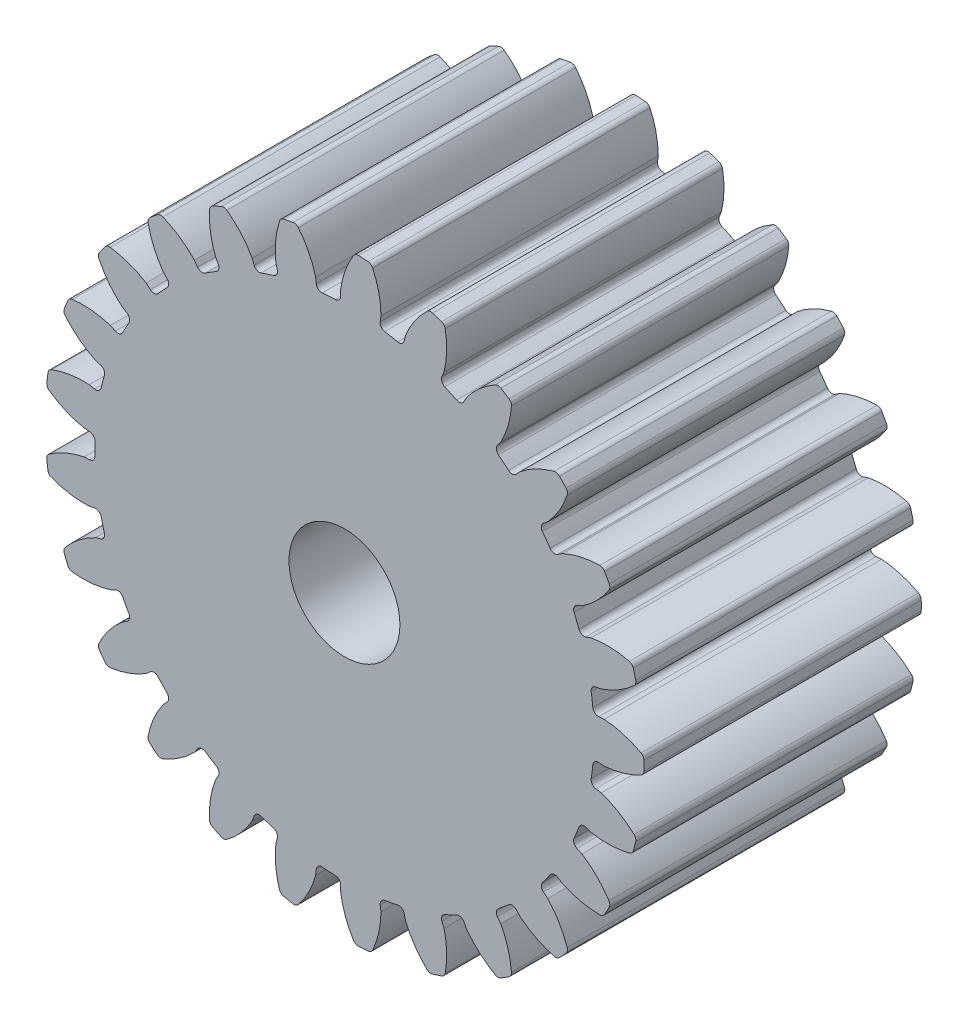
from build123d import *

# Parameters (mm, degrees)
SKETCH_1_R                       = 4.5
SKETCH_1_R_2                     = 1
EXTRUDE_1_DEPTH                  = 2.5
EXTRUDE_2_REACH                  = 8.837
EXTRUDE_2_DIRECTION_2_REACH      = 8.837
FILLET_1_R                       = 0.1
PATTERN_CIRCULAR_1_COUNT         = 25
FILLET_1_OF_PATTERN_CIRCULAR_1_R = 0.1


with BuildPart() as part:
    # Эскиз1 → Бобышка-Вытянуть1 (new, symmetric)
    with BuildSketch(Plane.XY):
        Circle(SKETCH_1_R)
        Circle(SKETCH_1_R_2, mode=Mode.SUBTRACT)
    extrude(amount=EXTRUDE_1_DEPTH, both=True)

    # Бобышка-Вытянуть2: up to this face of the body (flat: up to its plane)
    extrude_2_end = Plane(part.part.faces().sort_by_distance((-4.372720779, 0, 2.5))[0])
    # Эскиз2 → Бобышка-Вытянуть2 (add, up to the picked face)
    with BuildSketch(Plane.XY, mode=Mode.PRIVATE) as extrude_2_sk1:
        with BuildLine():
            Line((-0.070025105, 4.697941254), (-0.067067244, 4.499500193))
            ThreePointArc((-0.067067244, 4.499500193), (0.282557338, 4.491120278), (0.630475308, 4.455614535))
            Line((0.630475308, 4.455614535), (0.658281105, 4.652120111))
            add(Edge.make_bspline(
                [(0.658281105, 4.652120111), (0.654668824, 5.03383098), (0.482611094, 5.378390701)],
                knots=[0, 0, 0, 1, 1, 1], degree=2))
            ThreePointArc((0.482611094, 5.378390701), (0.339068805, 5.389344334), (0.195285537, 5.396467693))
            add(Edge.make_bspline(
                [(-0.070025105, 4.697941254), (-0.018600251, 5.07618948), (0.195285537, 5.396467693)],
                knots=[0, 0, 0, 1, 1, 1], degree=2))
        make_face()
    extrude_2_tool1 = split(extrude(extrude_2_sk1.sketch, amount=EXTRUDE_2_REACH, mode=Mode.PRIVATE), bisect_by=extrude_2_end, keep=Keep.BOTH, mode=Mode.PRIVATE)
    extrude_2 = extrude_2_tool1.solids().sort_by(Axis((0.307346, 4.885132, 0), (0, 0, 1)))[0]
    add(extrude_2)

    # Бобышка-Вытянуть2 direction 2: up to this face of the body (flat: up to its plane)
    extrude_2_direction_2_end = Plane(part.part.faces().sort_by_distance((-4.372720779, 0, -2.5))[0])
    # Эскиз2 → Бобышка-Вытянуть2 direction 2 (add, up to the picked face)
    with BuildSketch(Plane.XY, mode=Mode.PRIVATE) as extrude_2_direction_2_sk1:
        with BuildLine():
            Line((-0.070025105, 4.697941254), (-0.067067244, 4.499500193))
            ThreePointArc((-0.067067244, 4.499500193), (0.282557338, 4.491120278), (0.630475308, 4.455614535))
            Line((0.630475308, 4.455614535), (0.658281105, 4.652120111))
            add(Edge.make_bspline(
                [(0.658281105, 4.652120111), (0.654668824, 5.03383098), (0.482611094, 5.378390701)],
                knots=[0, 0, 0, 1, 1, 1], degree=2))
            ThreePointArc((0.482611094, 5.378390701), (0.339068805, 5.389344334), (0.195285537, 5.396467693))
            add(Edge.make_bspline(
                [(-0.070025105, 4.697941254), (-0.018600251, 5.07618948), (0.195285537, 5.396467693)],
                knots=[0, 0, 0, 1, 1, 1], degree=2))
        make_face()
    extrude_2_direction_2_tool1 = split(extrude(extrude_2_direction_2_sk1.sketch, amount=-EXTRUDE_2_DIRECTION_2_REACH, mode=Mode.PRIVATE), bisect_by=extrude_2_direction_2_end, keep=Keep.BOTH, mode=Mode.PRIVATE)
    extrude_2_direction_2 = extrude_2_direction_2_tool1.solids().sort_by(Axis((0.307346, 4.885132, 0), (0, 0, -1)))[0]
    add(extrude_2_direction_2)

    # Скругление1
    fillet_1_edges = [part.edges().sort_by_distance(p)[0] for p in [
        (-0.067067244, 4.499500193, 0),
        (0.630475308, 4.455614535, 0),
        (0.482611094, 5.378390701, 1.25),
        (0.195285537, 5.396467693, -1.25),
    ]]
    fillet(fillet_1_edges, radius=FILLET_1_R)

    # Круговой массив1: Бобышка-Вытянуть2, Бобышка-Вытянуть2 direction 2 ×25 about axis
    pattern_circular_1_axis = Axis((0, 0, 2.5), (0, 0, -1))
    add([extrude_2.rotate(pattern_circular_1_axis, i * 360 / PATTERN_CIRCULAR_1_COUNT) for i in range(1, PATTERN_CIRCULAR_1_COUNT)])
    add([extrude_2_direction_2.rotate(pattern_circular_1_axis, i * 360 / PATTERN_CIRCULAR_1_COUNT) for i in range(1, PATTERN_CIRCULAR_1_COUNT)])

    # Скругление1 of Круговой массив1
    fillet_1_of_pattern_circular_1_edges = [part.edges().sort_by_distance(p)[0] for p in [
        (1.054019992, 4.374819066, 0),
        (1.718734042, 4.158840378, 0),
        (1.805000355, 5.089398168, 1.25),
        (1.531197224, 5.178362199, -1.25),
        (2.108879275, 3.975251967, 0),
        (2.698998396, 3.600750985, 0),
        (3.013974806, 4.480620032, 1.25),
        (2.770898159, 4.634881163, -1.25),
        (3.031229918, 3.325905168, 0),
        (3.509674755, 2.816413165, 0),
        (4.033570135, 3.59030806, 1.25),
        (3.836493371, 3.800173498, -1.25),
        (3.763117237, 2.467579515, 0),
        (4.099825341, 1.855109748, 0),
        (4.799721419, 2.474403828, 1.25),
        (4.661027595, 2.726686956, -1.25),
        (4.25855406, 1.454206765, 0),
        (4.432368822, 0.777242962, 0),
        (5.264288553, 1.203023703, 1.25),
        (5.192692314, 1.481872644, -1.25),
        (4.48641027, 0.349460857, 0),
        (4.48641027, -0.349460857, 0),
        (5.398081077, -0.143946825, 1.25),
        (5.398081077, 0.143946825, -1.25),
        (4.432368822, -0.777242962, 0),
        (4.25855406, -1.454206765, 0),
        (5.192692314, -1.481872644, 1.25),
        (5.264288553, -1.203023703, -1.25),
        (4.099825341, -1.855109748, 0),
        (3.763117237, -2.467579515, 0),
        (4.661027595, -2.726686956, 1.25),
        (4.799721419, -2.474403828, -1.25),
        (3.509674755, -2.816413165, 0),
        (3.031229918, -3.325905168, 0),
        (3.836493371, -3.800173498, 1.25),
        (4.033570135, -3.59030806, -1.25),
        (2.698998396, -3.600750985, 0),
        (2.108879275, -3.975251967, 0),
        (2.770898159, -4.634881163, 1.25),
        (3.013974806, -4.480620032, -1.25),
        (1.718734042, -4.158840378, 0),
        (1.054019992, -4.374819066, 0),
        (1.531197224, -5.178362199, 1.25),
        (1.805000355, -5.089398168, -1.25),
        (0.630475308, -4.455614535, 0),
        (-0.067067244, -4.499500193, 0),
        (0.195285537, -5.396467693, 1.25),
        (0.482611094, -5.378390701, -1.25),
        (-0.49739851, -4.472426044, 0),
        (-1.183940399, -4.341461175, 0),
        (-1.152896659, -5.275493275, 1.25),
        (-0.870102398, -5.329439165, -1.25),
        (-1.594018949, -4.208218577, 0),
        (-2.226422224, -3.910632184, 0),
        (-2.428638118, -4.823040213, 1.25),
        (-2.168144156, -4.945619367, -1.25),
        (-2.590481316, -3.679593259, 0),
        (-3.129009752, -3.234083792, 0),
        (-3.551779312, -4.067537796, 1.25),
        (-3.329953442, -4.251048115, -1.25),
        (-3.424174214, -2.919765565, 0),
        (-3.83499009, -2.35432602, 0),
        (-4.451749149, -3.05645702, 1.25),
        (-4.282529508, -3.289367875, -1.25),
        (-4.042713653, -1.976478261, 0),
        (-4.300003897, -1.326637286, 0),
        (-5.071999215, -1.853327809, 1.25),
        (-4.966018494, -2.121004555, -1.25),
        (-4.407234526, -0.90900156, 0),
        (-4.494832644, -0.215591052, 0),
        (-5.373556916, -0.533747195, 1.25),
        (-5.337474274, -0.819370717, -1.25),
        (-4.494832644, 0.215591052, 0),
        (-4.407234526, 0.90900156, 0),
        (-5.337474274, 0.819370717, 1.25),
        (-5.373556916, 0.533747195, -1.25),
        (-4.300003897, 1.326637286, 0),
        (-4.042713653, 1.976478261, 0),
        (-4.966018494, 2.121004555, 1.25),
        (-5.071999215, 1.853327809, -1.25),
        (-3.83499009, 2.35432602, 0),
        (-3.424174214, 2.919765565, 0),
        (-4.282529508, 3.289367875, 1.25),
        (-4.451749149, 3.05645702, -1.25),
        (-3.129009752, 3.234083792, 0),
        (-2.590481316, 3.679593259, 0),
        (-3.329953442, 4.251048115, 1.25),
        (-3.551779312, 4.067537796, -1.25),
        (-2.226422224, 3.910632184, 0),
        (-1.594018949, 4.208218577, 0),
        (-2.168144156, 4.945619367, 1.25),
        (-2.428638118, 4.823040213, -1.25),
        (-1.183940399, 4.341461175, 0),
        (-0.49739851, 4.472426044, 0),
        (-0.870102398, 5.329439165, 1.25),
        (-1.152896659, 5.275493275, -1.25),
    ]]
    fillet(fillet_1_of_pattern_circular_1_edges, radius=FILLET_1_OF_PATTERN_CIRCULAR_1_R)


solid = part.part
